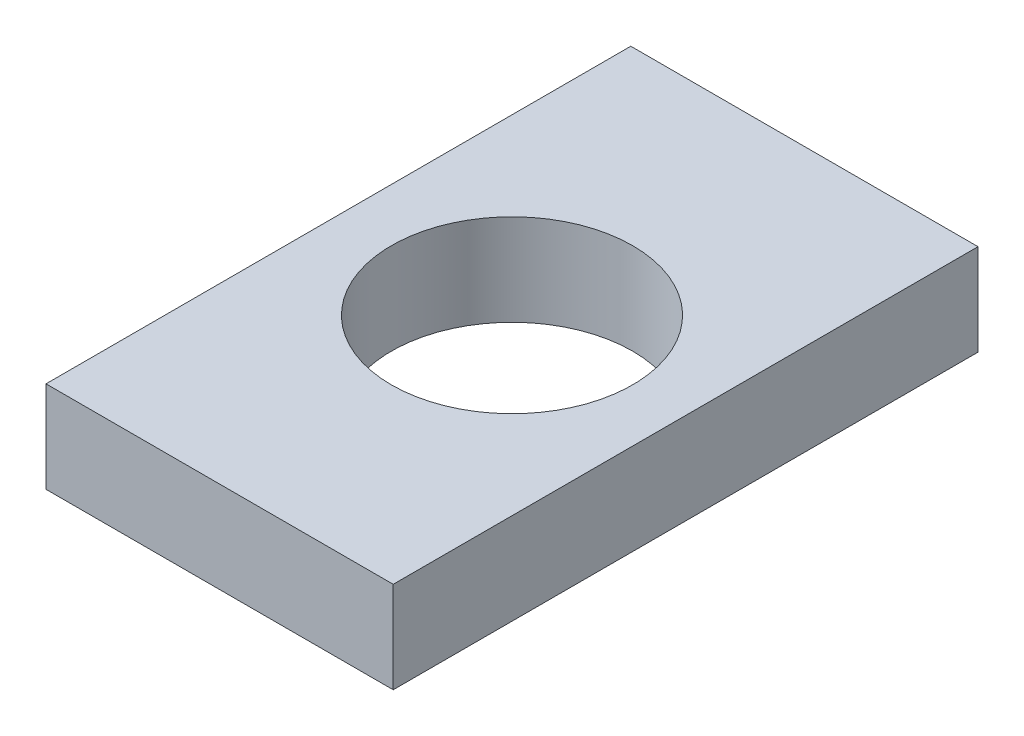
from build123d import *

# Parameters (mm, degrees)
SKETCH1_W             = 4.75
SKETCH1_H             = 8
BOSS_EXTRUDE1_DEPTH   = 1.25
M4X0_7_TAPPED_HOLE1_D = 3.3


with BuildPart() as part:
    # Sketch1 → Boss-Extrude1 (new body)
    with BuildSketch(Plane(origin=(0, 0, 0), x_dir=(1, 0, 0), z_dir=(0, 1, 0))):
        with Locations((2.375, 4)):
            Rectangle(SKETCH1_W, SKETCH1_H)
    extrude(amount=BOSS_EXTRUDE1_DEPTH)

    # M4x0.7 Tapped Hole1 (through all)
    with Locations(Plane(origin=(0, 1.25, 0), x_dir=(1, 0, 0), z_dir=(0, 1, 0))):
        with Locations((2.375, 4)):
            Hole(M4X0_7_TAPPED_HOLE1_D / 2)


solid = part.part
